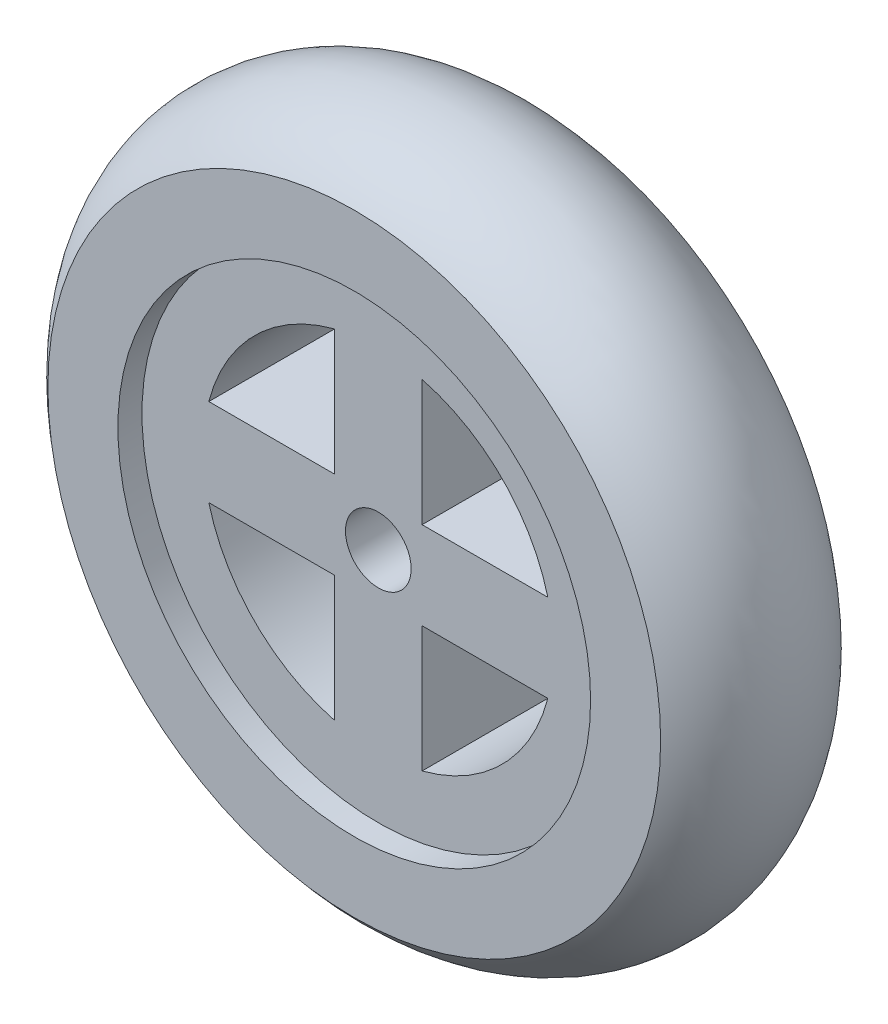
from build123d import *

# Parameters (mm, degrees)
SKETCH3_W               = 80
SKETCH3_H               = 30
BOSS_EXTRUDE1_DEPTH     = 10
CUT_EXTRUDE1_DEPTH      = 119.586469569
CUT_EXTRUDE1_DEPTH_BACK = 119.586469569
SKETCH5_R               = 7.5


with BuildPart() as part:
    # Sketch2 → Revolve1 (revolve)
    with BuildSketch(Plane(origin=(0, 0, 0), x_dir=(1, 0, 0), z_dir=(0, 1, 0))):
        with BuildLine():
            Line((54, 15), (54, 20.5))
            Line((54, 20.5), (70, 20.5))
            ThreePointArc((70, 20.5), (80.007814408, 0), (70, -20.5))
            Line((70, -20.5), (54, -20.5))
            Line((54, -20.5), (54, -15))
            Line((54, -15), (40, -15))
            Line((40, -15), (40, 15))
            Line((40, 15), (54, 15))
        make_face()
    revolve(axis=Axis((0, 0, 729.455473156), (0, 0, -1)))

    # Sketch3 → Boss-Extrude1 (add, symmetric)
    with BuildSketch(Plane(origin=(0, 0, 0), x_dir=(1, 0, 0), z_dir=(0, 1, 0))):
        Rectangle(SKETCH3_W, SKETCH3_H)
    boss_extrude1 = extrude(amount=BOSS_EXTRUDE1_DEPTH, both=True)

    # Mirror1: Boss-Extrude1 across plane
    add(boss_extrude1.mirror(Plane(origin=(0, 0, 0), x_dir=(0, 0, 1), z_dir=(-0.7071067811865488, 0.7071067811865464, 2.4688501310822697e-15))))

    # Sketch5 → Cut-Extrude1 (cut, two sides: drawn at the far end of the back side and taken through both)
    with BuildSketch(Plane(origin=(0, 0, -15), x_dir=(-1, 0, 0), z_dir=(0, 0, -1)).offset(-CUT_EXTRUDE1_DEPTH_BACK)):
        Circle(SKETCH5_R)
    extrude(amount=CUT_EXTRUDE1_DEPTH + CUT_EXTRUDE1_DEPTH_BACK, mode=Mode.SUBTRACT)


solid = part.part
